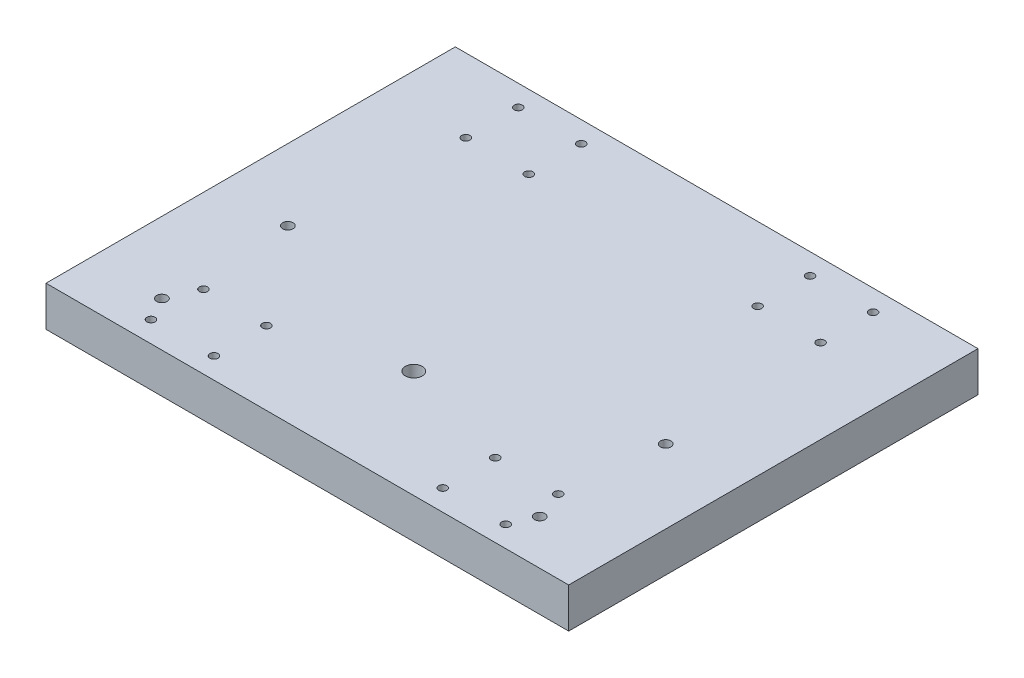
from build123d import *

# Parameters (mm, degrees)
SKETCH1_W             = 249
SKETCH1_H             = 195
SKETCH1_R             = 1.95
BOSS_EXTRUDE1_DEPTH   = 19.05
M6X1_0_TAPPED_HOLE1_D = 5
F_8_0MM_DOWEL_HOLE1_D = 8


with BuildPart() as part:
    # Sketch1 → Boss-Extrude1 (new body)
    with BuildSketch(Plane(origin=(0, 0, 0), x_dir=(1, 0, 0), z_dir=(0, 1, 0))):
        with Locations((54.5, 53.449182879)):
            Rectangle(SKETCH1_W, SKETCH1_H)
        with Locations(Location((-30, -9.050817121, 0), (0, 0, 90))):
            Circle(SKETCH1_R, mode=Mode.SUBTRACT)
        with Locations(Location((0, -9.050817121, 0), (0, 0, 90))):
            Circle(SKETCH1_R, mode=Mode.SUBTRACT)
        with Locations(Location((0, -34.050817121, 0), (0, 0, 90))):
            Circle(SKETCH1_R, mode=Mode.SUBTRACT)
        with Locations(Location((-30, -34.050817121, 0), (0, 0, 90))):
            Circle(SKETCH1_R, mode=Mode.SUBTRACT)
        with Locations(Location((109, -34.050817121, 0), (0, 0, 90))):
            Circle(SKETCH1_R, mode=Mode.SUBTRACT)
        with Locations(Location((109, -9.050817121, 0), (0, 0, 90))):
            Circle(SKETCH1_R, mode=Mode.SUBTRACT)
        with Locations(Location((139, -9.050817121, 0), (0, 0, 90))):
            Circle(SKETCH1_R, mode=Mode.SUBTRACT)
        with Locations(Location((139, -34.050817121, 0), (0, 0, 90))):
            Circle(SKETCH1_R, mode=Mode.SUBTRACT)
        with Locations(Location((109, 115.949182879, 0), (0, 0, 90))):
            Circle(SKETCH1_R, mode=Mode.SUBTRACT)
        with Locations(Location((109, 140.949182879, 0), (0, 0, 90))):
            Circle(SKETCH1_R, mode=Mode.SUBTRACT)
        with Locations(Location((139, 140.949182879, 0), (0, 0, 90))):
            Circle(SKETCH1_R, mode=Mode.SUBTRACT)
        with Locations(Location((139, 115.949182879, 0), (0, 0, 90))):
            Circle(SKETCH1_R, mode=Mode.SUBTRACT)
        with Locations(Location((-30, 115.949182879, 0), (0, 0, 90))):
            Circle(SKETCH1_R, mode=Mode.SUBTRACT)
        with Locations(Location((-30, 140.949182879, 0), (0, 0, 90))):
            Circle(SKETCH1_R, mode=Mode.SUBTRACT)
        with Locations(Location((0, 140.949182879, 0), (0, 0, 90))):
            Circle(SKETCH1_R, mode=Mode.SUBTRACT)
        with Locations(Location((0, 115.949182879, 0), (0, 0, 90))):
            Circle(SKETCH1_R, mode=Mode.SUBTRACT)
    extrude(amount=BOSS_EXTRUDE1_DEPTH)

    # M6x1.0 Tapped Hole1 (through all)
    with Locations(Plane(origin=(0, 19.05, 0), x_dir=(1, 0, 0), z_dir=(0, 1, 0))):
        with Locations((-36.092306809, 37.249182879), (143.907693191, 37.249182879), (143.907693191, -22.750817121), (-36.092306809, -22.750817121)):
            Hole(M6X1_0_TAPPED_HOLE1_D / 2)

    # Ø8.0mm Dowel Hole1 (through all)
    with Locations(Plane(origin=(0, 19.05, 0), x_dir=(1, 0, 0), z_dir=(0, 1, 0))):
        with Locations((53.907693191, 7.249182879)):
            Hole(F_8_0MM_DOWEL_HOLE1_D / 2)


solid = part.part
